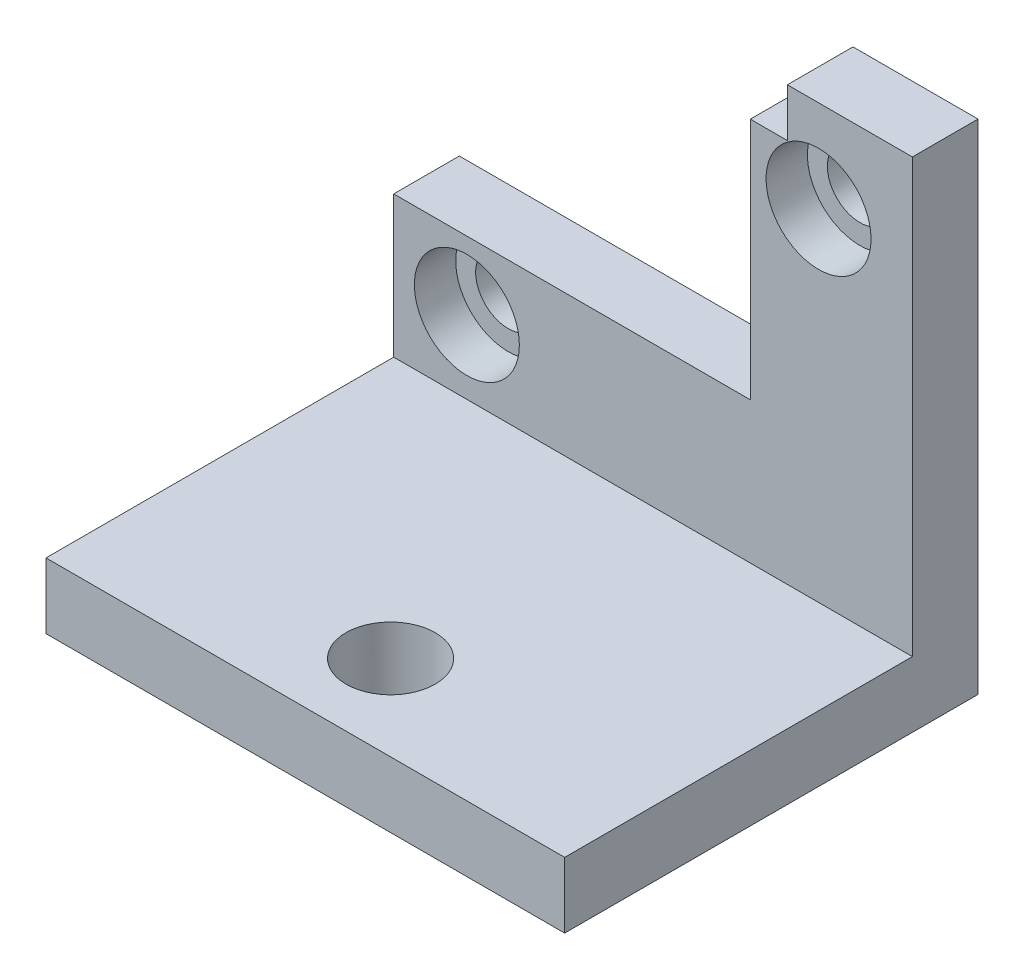
from build123d import *

# Parameters (mm, degrees)
SKETCH2_R           = 1.5748
SKETCH2_W           = 1
SKETCH2_H           = 6.842
BOSS_EXTRUDE1_DEPTH = 3.175
SKETCH3_W           = 25.098
SKETCH3_H           = 3.175
BOSS_EXTRUDE3_DEPTH = 20
SKETCH4_R           = 2.159
CUT_EXTRUDE1_DEPTH  = 34.8656879
SKETCH5_R           = 2.54
CUT_EXTRUDE2_DEPTH  = 2


with BuildPart() as part:
    # Sketch2 → Boss-Extrude1 (new body)
    # profile 1 of 2: a face of its own
    with BuildSketch(Plane.XY):
        Polygon((4.395213829, 10.321811953), (4.395213829, 7.827388121), (4.395213829, -1.438404904), (-11.860786171, -1.438404904), (-11.860786171, -8.280404904), (12.237213829, -8.280404904), (12.237213829, 12.658595096), (7.697213829, 12.658595096), (6.188170382, 12.658595096), (6.188170382, 10.321811953), align=None)
        with Locations((-9.320786171, -4.740404904)):
            Circle(SKETCH2_R, mode=Mode.SUBTRACT)
        with Locations((7.697213829, 8.213595096)):
            Circle(SKETCH2_R, mode=Mode.SUBTRACT)
    # profile 2 of 2: a face of its own
    with BuildSketch(Plane.XY):
        with Locations((-12.360786171, -4.859404904)):
            Rectangle(SKETCH2_W, SKETCH2_H)
    extrude(amount=BOSS_EXTRUDE1_DEPTH)

    # Sketch3 → Boss-Extrude3 (add)
    with BuildSketch(Plane(origin=(0, 0, 0), x_dir=(-1, 0, 0), z_dir=(0, 0, -1))):
        with Locations((0.311786171, -9.867904904)):
            Rectangle(SKETCH3_W, SKETCH3_H)
    extrude(amount=-BOSS_EXTRUDE3_DEPTH)

    # Sketch4 → Cut-Extrude1 (cut, through all)
    with BuildSketch(Plane.XZ.offset(11.455404904)):
        with Locations(Location((-0.311786171, 15.875, 0), (0, 0, 270))):
            Circle(SKETCH4_R)
    extrude(amount=-CUT_EXTRUDE1_DEPTH, mode=Mode.SUBTRACT)

    # Sketch5 → Cut-Extrude2 (cut)
    with BuildSketch(Plane.XY.offset(3.175)):
        with Locations((7.697213829, 8.213595096)):
            Circle(SKETCH5_R)
        with Locations((-9.320786171, -4.740404904)):
            Circle(SKETCH5_R)
    extrude(amount=-CUT_EXTRUDE2_DEPTH, mode=Mode.SUBTRACT)


solid = part.part
